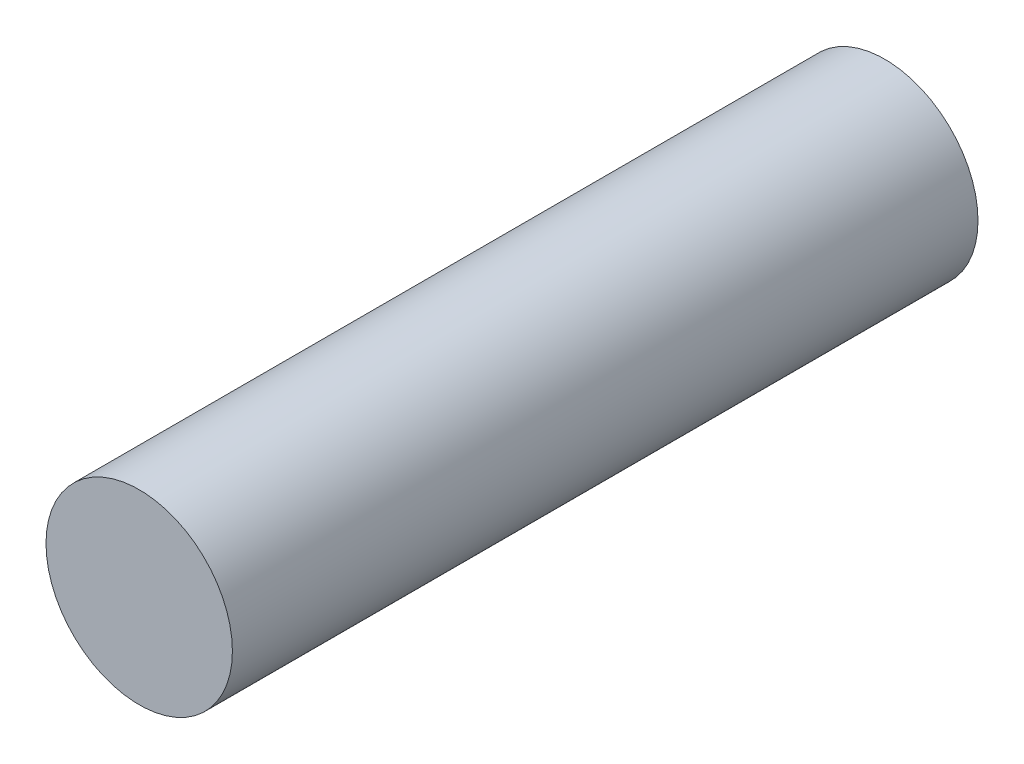
from build123d import *

# Parameters (mm, degrees)
SKETCH2_R           = 3.175
BOSS_EXTRUDE1_DEPTH = 25.4


with BuildPart() as part:
    # Sketch2 → Boss-Extrude1 (new body)
    with BuildSketch(Plane.XY):
        Circle(SKETCH2_R)
    extrude(amount=BOSS_EXTRUDE1_DEPTH)


solid = part.part
